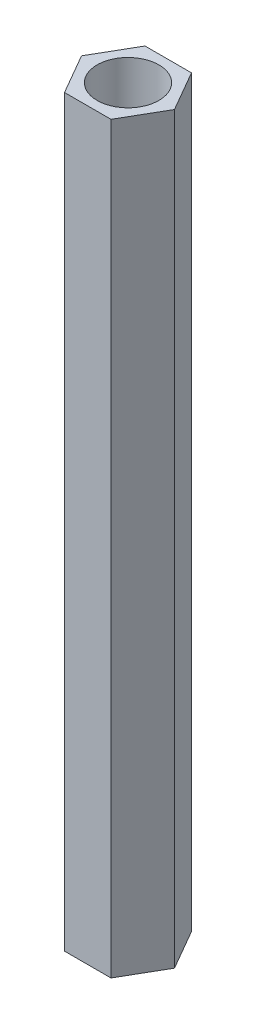
from build123d import *

# Parameters (mm, degrees)
BOSS_EXTRUDE1_DEPTH = 40
SKETCH2_R           = 1.660385814
CUT_EXTRUDE1_DEPTH  = 41.136485895


with BuildPart() as part:
    # Sketch1 → Boss-Extrude1 (new body)
    with BuildSketch(Plane(origin=(0, 0, 0), x_dir=(1, 0, 0), z_dir=(0, 1, 0))):
        Polygon((2.5, 0), (1.25, 2.165063509), (-1.25, 2.165063509), (-2.5, 0), (-1.25, -2.165063509), (1.25, -2.165063509), align=None)
    extrude(amount=BOSS_EXTRUDE1_DEPTH)

    # Sketch2 → Cut-Extrude1 (cut, through all)
    with BuildSketch(Plane(origin=(0, 40, 0), x_dir=(1, 0, 0), z_dir=(0, 1, 0))):
        with Locations(Location((0, 0, 0), (0, 0, 270))):
            Circle(SKETCH2_R)
    extrude(amount=-CUT_EXTRUDE1_DEPTH, mode=Mode.SUBTRACT)


solid = part.part
